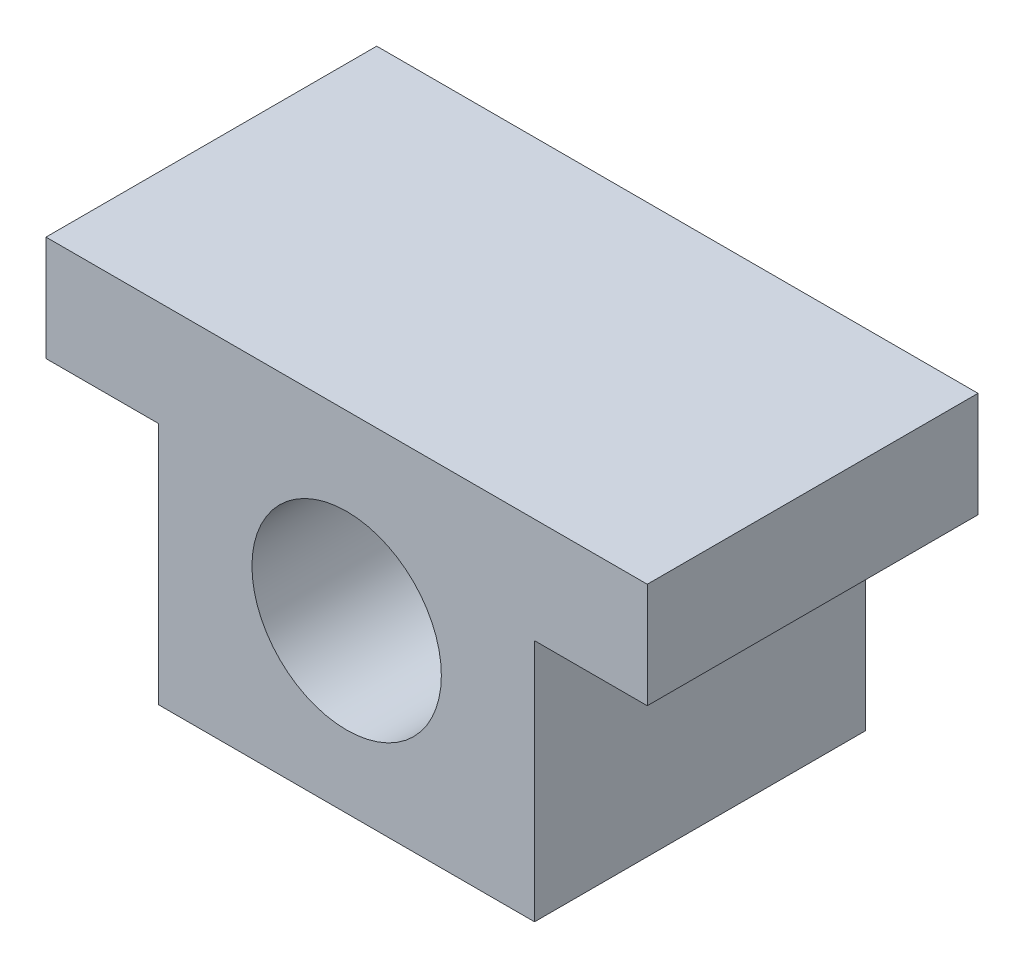
from build123d import *

# Parameters (mm, degrees)
EXTRUDE_1_DEPTH          = 110
CUT_EXTRUDE_1_REACH      = 180.332
SKETCH_2_R               = 31.5
PATTERN_CIRCULAR_1_COUNT = 4
PATTERN_CIRCULAR_1_ANGLE = 90


with BuildPart() as part:
    # 草图1 → 凸台-拉伸1 (new body)
    with BuildSketch(Plane.XY):
        Polygon((-100, -17.5), (-62.5, -17.5), (-62.5, -98.5), (62.5, -98.5), (62.5, -17.5), (100, -17.5), (100, 17.5), (-100, 17.5), align=None)
    extrude(amount=EXTRUDE_1_DEPTH)

    # 草图2 → 切除-拉伸1 (cut, up to next)
    with BuildSketch(Plane(origin=(0, 0, 0), x_dir=(-1, 0, 0), z_dir=(0, 0, -1)), mode=Mode.PRIVATE) as cut_extrude_1_sk1:
        with Locations((0, -43)):
            Circle(SKETCH_2_R)
    cut_extrude_1_tool1 = extrude(cut_extrude_1_sk1.sketch, amount=-CUT_EXTRUDE_1_REACH, mode=Mode.PRIVATE) & part.part
    add(cut_extrude_1_tool1.solids().sort_by_distance((0, -43, 0))[0], mode=Mode.SUBTRACT)

    # 草图5 → M10 螺纹孔1 (revolve, cut)
    with BuildSketch(Plane(origin=(-32.88, -10.119069356, 0), x_dir=(0, 1, 0), z_dir=(1, 0, 0))):
        Polygon((0, 0), (0, 30), (4.25, 27.446342369), (4.25, 0), align=None)
    hole_wizard_m10_1 = revolve(axis=Axis((-32.88, -10.119069356, -6.35), (0, 0, 1)), mode=Mode.SUBTRACT)

    # 阵列(圆周)1: M10 螺纹孔1 ×4 about axis
    pattern_circular_1_axis = Axis((0, -43, 0), (0, 0, 1))
    for i in range(1, PATTERN_CIRCULAR_1_COUNT):
        add(hole_wizard_m10_1.rotate(pattern_circular_1_axis, i * PATTERN_CIRCULAR_1_ANGLE / (PATTERN_CIRCULAR_1_COUNT - 1)), mode=Mode.SUBTRACT)

    # 镜向1: M10 螺纹孔1 across plane
    add(hole_wizard_m10_1.mirror(Plane(origin=(0, 0, 0), x_dir=(0, 0, 1), z_dir=(1, 0, 0))), mode=Mode.SUBTRACT)

    # 镜向1 copy 1 sketch → 镜向1 copy 1 (revolve, cut)
    with BuildSketch(Plane(origin=(44.915380598, -30.964278762, 0), x_dir=(0.5000000000000011, 0.866025403784438, 0), z_dir=(-0.866025403784438, 0.5000000000000011, 0))):
        Polygon((0, 0), (0, -30), (4.25, -27.446342369), (4.25, 0), align=None)
    revolve(axis=Axis((44.915380598, -30.964278762, -6.35), (0, 0, -1)), mode=Mode.SUBTRACT)

    # 镜向1 copy 2 sketch → 镜向1 copy 2 (revolve, cut)
    with BuildSketch(Plane(origin=(44.915721238, -55.034449955, 0), x_dir=(0.8660254037844399, 0.4999999999999978, 0), z_dir=(-0.4999999999999978, 0.8660254037844399, 0))):
        Polygon((0, 0), (0, -30), (4.25, -27.446342369), (4.25, 0), align=None)
    revolve(axis=Axis((44.915721238, -55.034449955, -6.35), (0, 0, -1)), mode=Mode.SUBTRACT)

    # 镜向1 copy 3 sketch → 镜向1 copy 3 (revolve, cut)
    with BuildSketch(Plane(origin=(32.880930644, -75.88, 0), x_dir=(1, 0, 0), z_dir=(0, 1, 0))):
        Polygon((0, 0), (0, -30), (4.25, -27.446342369), (4.25, 0), align=None)
    revolve(axis=Axis((32.880930644, -75.88, -6.35), (0, 0, -1)), mode=Mode.SUBTRACT)


solid = part.part
